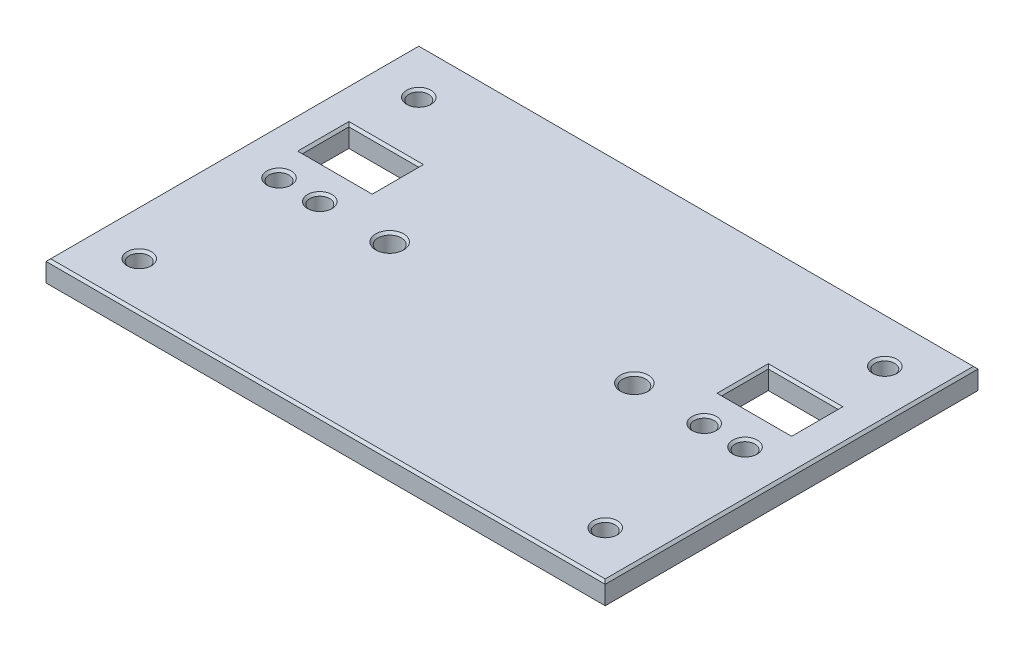
from build123d import *

# Parameters (mm, degrees)
SKETCH1_W           = 120
SKETCH1_H           = 80
SKETCH1_R           = 2.125
SKETCH1_R_2         = 2.5
BOSS_EXTRUDE1_DEPTH = 5
SKETCH3_W           = 15
SKETCH3_H           = 10
CUT_EXTRUDE1_DEPTH  = 5
CHAMFER2_SIZE       = 0.5
CHAMFER3_SIZE       = 0.5


with BuildPart() as part:
    # Sketch1 → Boss-Extrude1 (new body)
    with BuildSketch(Plane(origin=(0, 0, 0), x_dir=(1, 0, 0), z_dir=(0, 1, 0))):
        Rectangle(SKETCH1_W, SKETCH1_H)
        with Locations(Location((-50, 30, 0), (0, 0, 270))):
            Circle(SKETCH1_R, mode=Mode.SUBTRACT)
        with Locations(Location((-50, -30, 0), (0, 0, 90))):
            Circle(SKETCH1_R, mode=Mode.SUBTRACT)
        with Locations(Location((50, -30, 0), (0, 0, 270))):
            Circle(SKETCH1_R, mode=Mode.SUBTRACT)
        with Locations(Location((50, 30, 0), (0, 0, 90))):
            Circle(SKETCH1_R, mode=Mode.SUBTRACT)
        with Locations(Location((-26.25, 0, 0), (0, 0, 270))):
            Circle(SKETCH1_R_2, mode=Mode.SUBTRACT)
        with Locations(Location((26.25, 0, 0), (0, 0, 90))):
            Circle(SKETCH1_R_2, mode=Mode.SUBTRACT)
        with Locations(Location((-50, 0, 0), (0, 0, 270))):
            Circle(SKETCH1_R, mode=Mode.SUBTRACT)
        with Locations(Location((50, 0, 0), (0, 0, 90))):
            Circle(SKETCH1_R, mode=Mode.SUBTRACT)
        with Locations(Location((41.25, 0, 0), (0, 0, 270))):
            Circle(SKETCH1_R, mode=Mode.SUBTRACT)
        with Locations(Location((-41.25, 0, 0), (0, 0, 90))):
            Circle(SKETCH1_R, mode=Mode.SUBTRACT)
    extrude(amount=BOSS_EXTRUDE1_DEPTH)

    # Sketch3 → Cut-Extrude1 (cut)
    with BuildSketch(Plane.XZ):
        with Locations((45, -12.5)):
            Rectangle(SKETCH3_W, SKETCH3_H)
        with Locations((-45, -12.5)):
            Rectangle(SKETCH3_W, SKETCH3_H)
    extrude(amount=-CUT_EXTRUDE1_DEPTH, mode=Mode.SUBTRACT)

    # Chamfer2
    chamfer2_edges = [part.edges().sort_by_distance(p)[0] for p in [
        (-50, 5, -32.125),
        (-60, 5, 0),
        (50, 5, 27.875),
        (0, 5, 40),
        (-50, 5, 32.125),
        (50, 5, -27.875),
        (-26.25, 5, -2.5),
        (26.25, 5, 2.5),
        (-50, 5, -2.125),
        (50, 5, 2.125),
        (41.25, 5, -2.125),
        (-41.25, 5, 2.125),
        (60, 5, 0),
        (52.5, 5, -12.5),
        (45, 5, -17.5),
        (37.5, 5, -12.5),
        (45, 5, -7.5),
        (-37.5, 5, -12.5),
        (-45, 5, -17.5),
        (-52.5, 5, -12.5),
        (-45, 5, -7.5),
        (0, 5, -40),
    ]]
    chamfer(chamfer2_edges, length=CHAMFER2_SIZE)

    # Chamfer3
    chamfer3_edges = [part.edges().sort_by_distance(p)[0] for p in [
        (-50, 0, -32.125),
        (50, 0, 27.875),
        (-50, 0, 32.125),
        (50, 0, -27.875),
        (-26.25, 0, -2.5),
        (26.25, 0, 2.5),
        (-50, 0, -2.125),
        (50, 0, 2.125),
        (41.25, 0, -2.125),
        (-41.25, 0, 2.125),
        (0, 0, 40),
        (-60, 0, 0),
        (0, 0, -40),
        (60, 0, 0),
        (52.5, 0, -12.5),
        (45, 0, -7.5),
        (37.5, 0, -12.5),
        (45, 0, -17.5),
        (-37.5, 0, -12.5),
        (-45, 0, -7.5),
        (-52.5, 0, -12.5),
        (-45, 0, -17.5),
    ]]
    chamfer(chamfer3_edges, length=CHAMFER3_SIZE)


solid = part.part
